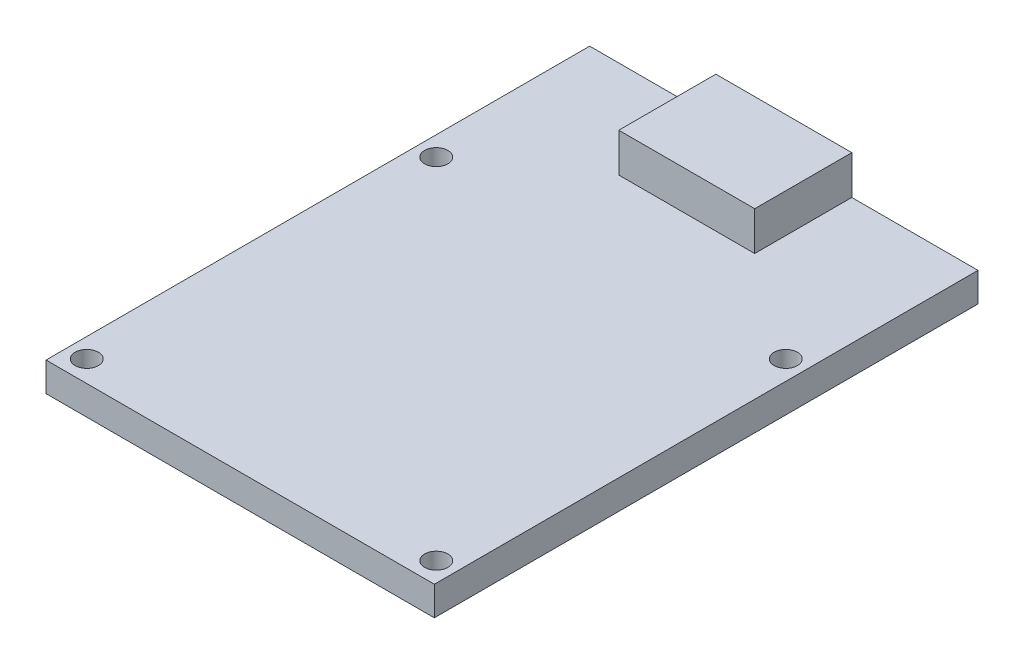
from build123d import *

# Parameters (mm, degrees)
SKETCH_1_W      = 40
SKETCH_1_H      = 56
EXTRUDE_1_DEPTH = 3
HOLE_WIZARD_1_D = 2.4
EXTRUDE_2_DEPTH = 4


with BuildPart() as part:
    # 草图1 → 凸台-拉伸1 (new body)
    with BuildSketch(Plane(origin=(0, 0, 0), x_dir=(1, 0, 0), z_dir=(0, 1, 0))):
        Rectangle(SKETCH_1_W, SKETCH_1_H)
    extrude(amount=EXTRUDE_1_DEPTH)

    # 孔1 (through all)
    with Locations(Plane(origin=(0, 3, 0), x_dir=(1, 0, 0), z_dir=(0, 1, 0))):
        with Locations((-18, 10.2), (18, 10.2), (18, -25.8), (-18, -25.8)):
            Hole(HOLE_WIZARD_1_D / 2)

    # 草图5 → 凸台-拉伸2 (add)
    with BuildSketch(Plane(origin=(0, 3, 0), x_dir=(1, 0, 0), z_dir=(0, 1, 0))):
        Polygon((-7, 28), (-7, 18), (7, 18), (7, 28), (0, 28), align=None)
    extrude(amount=EXTRUDE_2_DEPTH)


solid = part.part
